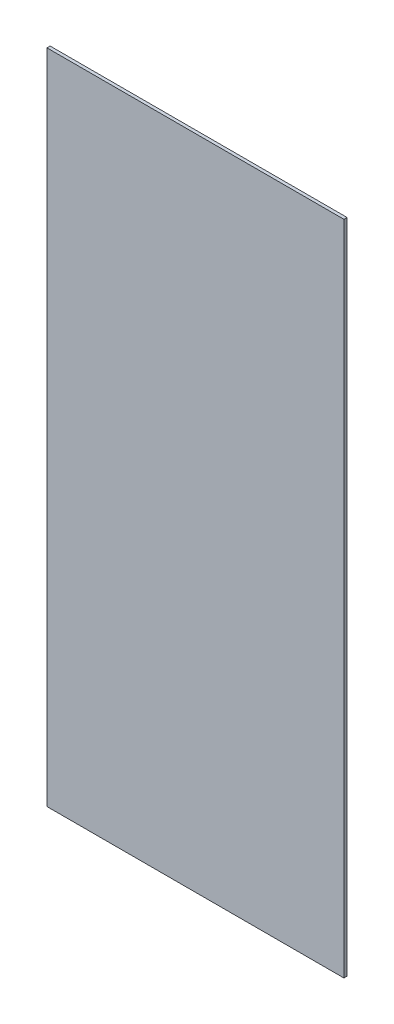
from build123d import *

# Parameters (mm, degrees)
ESBO_O1_W                = 94
ESBO_O1_H                = 208
RESSALTO_EXTRUS_O1_DEPTH = 1


with BuildPart() as part:
    # Esboço1 → Ressalto-extrusão1 (new body)
    with BuildSketch(Plane.XY):
        Rectangle(ESBO_O1_W, ESBO_O1_H)
    extrude(amount=RESSALTO_EXTRUS_O1_DEPTH)


solid = part.part
